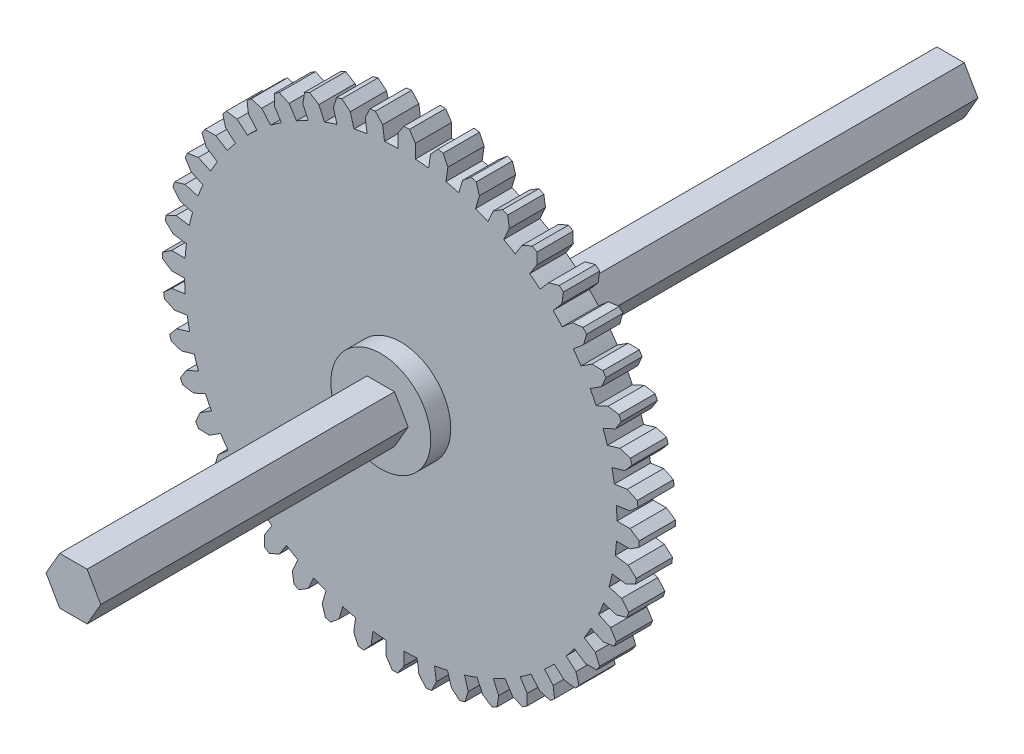
from build123d import *

# Parameters (mm, degrees)
SKETCH1_R                = 8.65
BOSS_EXTRUDE1_DEPTH      = 1.45
SKETCH2_R                = 2
BOSS_EXTRUDE3_DEPTH      = 0.8
BOSS_EXTRUDE4_DEPTH      = 12.3
BOSS_EXTRUDE4_DEPTH_BACK = 22.8
BOSS_EXTRUDE7_DEPTH      = 1.45
CIRPATTERN2_COUNT        = 44


with BuildPart() as part:
    # Sketch1 → Boss-Extrude1 (new body)
    with BuildSketch(Plane.XY):
        Circle(SKETCH1_R)
    extrude(amount=BOSS_EXTRUDE1_DEPTH)

    # Sketch2 → Boss-Extrude3 (add)
    with BuildSketch(Plane.XY.offset(1.45)):
        Circle(SKETCH2_R)
    extrude(amount=BOSS_EXTRUDE3_DEPTH)

    # Sketch3 → Boss-Extrude4 (add, two sides: drawn at the far end of the back side and taken through both)
    with BuildSketch(Plane.XY.offset(2.25).offset(-BOSS_EXTRUDE4_DEPTH_BACK)):
        Polygon((-1.096965511, 0), (-0.548482756, -0.95), (0.548482756, -0.95), (1.096965511, 0), (0.548482756, 0.95), (-0.548482756, 0.95), align=None)
    extrude(amount=BOSS_EXTRUDE4_DEPTH + BOSS_EXTRUDE4_DEPTH_BACK)

    # Sketch4 → Boss-Extrude7 (add)
    with BuildSketch(Plane.XY.offset(1.45)):
        Polygon((-0.118731885, 8.62289107), (-0.118731885, 9.173398177), (0.125166529, 9.538468229), (0.343742407, 9.538468229), (0.584410626, 9.173398177), (0.584410626, 8.605077525), align=None)
    boss_extrude7 = extrude(amount=-BOSS_EXTRUDE7_DEPTH)

    # CirPattern2: Boss-Extrude7 ×44 about axis
    cirpattern2_axis = Axis((0, 0, 0), (0, 0, 1))
    for i in range(1, CIRPATTERN2_COUNT):
        add(boss_extrude7.rotate(cirpattern2_axis, i * 360 / CIRPATTERN2_COUNT))


solid = part.part
